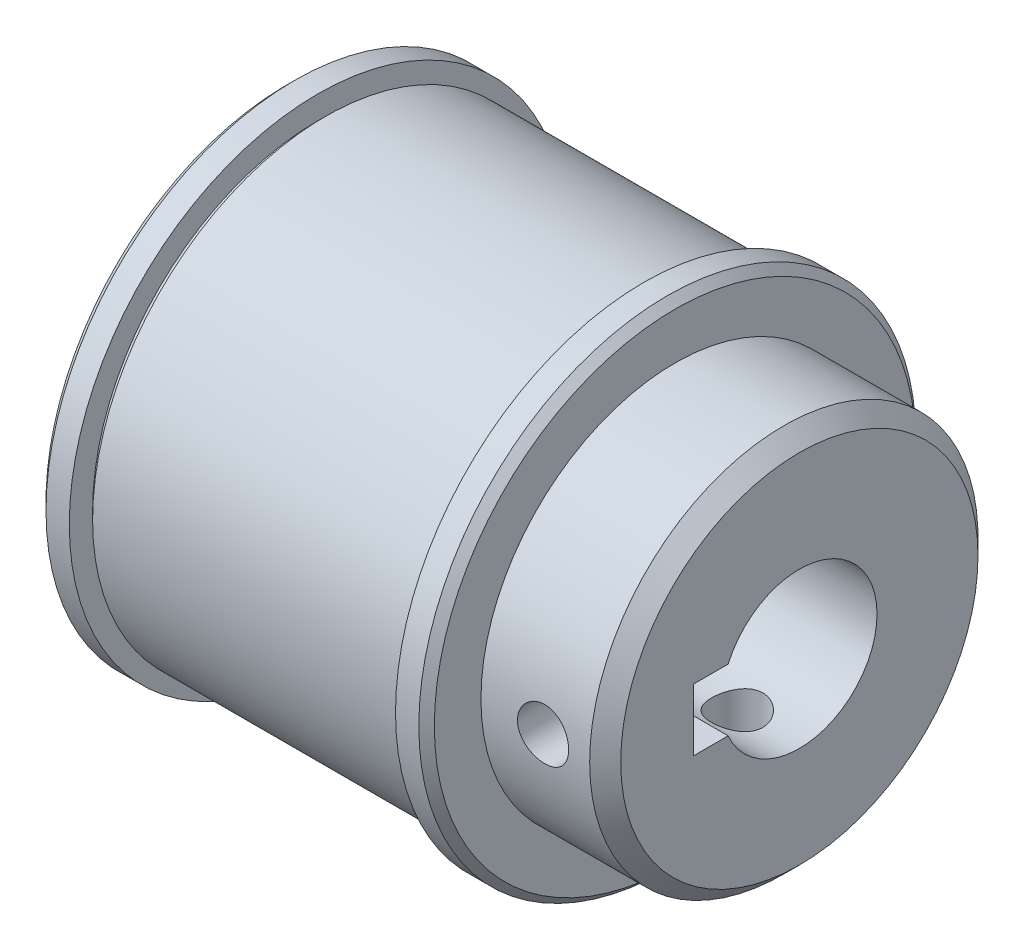
from build123d import *

# Parameters (mm, degrees)
SKETCH2_W                  = 33
SKETCH2_H                  = 5
SKETCH3_W                  = 2.217424305
SKETCH3_H                  = 4
CUT_EXTRUDE1_DEPTH         = 41.012498047
M4X0_7_TAPPED_HOLE1_REACH  = 48.446
M4X0_7_TAPPED_HOLE1_BORE_R = 1.65
CIRPATTERN1_COUNT          = 2
CIRPATTERN1_ANGLE          = 90
CHAMFER1_SIZE              = 1
CHAMFER2_SIZE              = 0.5


with BuildPart() as part:
    # Sketch1 → Revolve1 (revolve)
    with BuildSketch(Plane.XY, mode=Mode.PRIVATE) as revolve1_sk:
        Polygon((0, 0), (0, 16), (2, 16), (2, 14.5), (2.5, 14.5), (2.5, 15), (22.5, 15), (22.5, 14.5), (23, 14.5), (23, 16), (25, 16), (25, 12.5), (33, 12.5), (33, 0), align=None)
    revolve(revolve1_sk.sketch.rotate(Axis((-28.053191665, 0, 0), (1, 0, 0)), 90), axis=Axis((-28.053191665, 0, 0), (1, 0, 0)))

    # Sketch2 → Cut-Revolve1 (revolve, cut)
    with BuildSketch(Plane.XY, mode=Mode.PRIVATE) as cut_revolve1_sk:
        with Locations((16.5, 2.5)):
            Rectangle(SKETCH2_W, SKETCH2_H)
    revolve(cut_revolve1_sk.sketch.rotate(Axis((-6.491818973, 0, 0), (1, 0, 0)), 90), axis=Axis((-6.491818973, 0, 0), (1, 0, 0)), mode=Mode.SUBTRACT)

    # Sketch3 → Cut-Extrude1 (cut, through all)
    with BuildSketch(Plane(origin=(33, 0, 0), x_dir=(0, 0, -1), z_dir=(1, 0, 0))):
        with Locations((-5.691287847, 0)):
            Rectangle(SKETCH3_W, SKETCH3_H)
    extrude(amount=-CUT_EXTRUDE1_DEPTH, mode=Mode.SUBTRACT)

    # M4x0.7 Tapped Hole1 bore → M4x0.7 Tapped Hole1 (cut, up to next)
    with BuildSketch(Plane.XY.offset(12.5), mode=Mode.PRIVATE) as m4x0_7_tapped_hole1_sk1:
        with Locations((29, 0)):
            Circle(M4X0_7_TAPPED_HOLE1_BORE_R)
    m4x0_7_tapped_hole1_tool1 = extrude(m4x0_7_tapped_hole1_sk1.sketch, amount=-M4X0_7_TAPPED_HOLE1_REACH, mode=Mode.PRIVATE) & part.part
    m4x0_7_tapped_hole1 = m4x0_7_tapped_hole1_tool1.solids().sort_by_distance((29, 0, 12.5))[0]
    add(m4x0_7_tapped_hole1, mode=Mode.SUBTRACT)

    # CirPattern1: M4x0.7 Tapped Hole1; each copy of M4x0.7 Tapped Hole1 runs up to whatever stops it at its own place
    cirpattern1_before = part.part  # the part as the pattern finds it: every copy runs up to it
    cirpattern1_m4x0_7_tapped_hole1_long = extrude(m4x0_7_tapped_hole1_sk1.sketch, amount=-M4X0_7_TAPPED_HOLE1_REACH, mode=Mode.PRIVATE)
    cirpattern1_m4x0_7_tapped_hole1_tool1 = cirpattern1_m4x0_7_tapped_hole1_long.rotate(Axis((-6.491818973, 0, 0), (1, 0, 0)), 1 * CIRPATTERN1_ANGLE / (CIRPATTERN1_COUNT - 1)) & cirpattern1_before
    add(cirpattern1_m4x0_7_tapped_hole1_tool1.solids().sort_by_distance((29, -12.5, 0))[0], mode=Mode.SUBTRACT)

    # Chamfer1
    chamfer1_edges = [part.edges().sort_by_distance(p)[0] for p in [
        (33, 0, -12.5),
    ]]
    chamfer(chamfer1_edges, length=CHAMFER1_SIZE)

    # Chamfer2
    chamfer2_edges = [part.edges().sort_by_distance(p)[0] for p in [
        (25, 0, -16),
        (0, 0, -16),
    ]]
    chamfer(chamfer2_edges, length=CHAMFER2_SIZE)


solid = part.part
